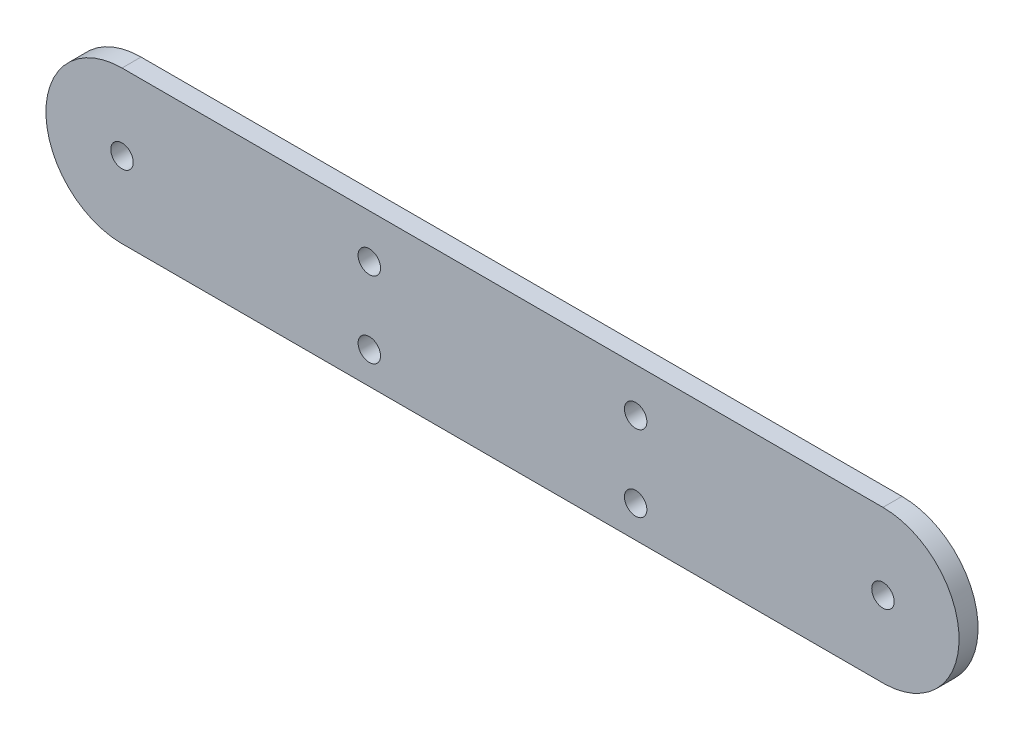
from build123d import *

# Parameters (mm, degrees)
EXTRUIR1_DEPTH        = 2.5
CROQUIS3_R            = 2.95
CORTAR_EXTRUIR1_DEPTH = 10
CROQUIS4_R            = 2.95
CORTAR_EXTRUIR2_DEPTH = 10


with BuildPart() as part:
    # Croquis2 → Extruir1 (new, symmetric)
    with BuildSketch(Plane.XY):
        with BuildLine():
            Line((100.628572724, -18.418297608), (-100.628572724, -18.418297608))
            ThreePointArc((-100.628572724, -18.418297608), (-119.997393731, 1.886143297), (-100, 21.57181808))
            Line((-100, 21.57181808), (100, 21.57181808))
            ThreePointArc((100, 21.57181808), (119.997393731, 1.886143297), (100.628572724, -18.418297608))
        make_face()
    extrude(amount=EXTRUIR1_DEPTH, both=True)

    # Croquis3 → Cortar-Extruir1 (cut)
    with BuildSketch(Plane.XY.offset(2.5)):
        with Locations(Location((99.999863892, 1.57181808, 0), (0, 0, 180))):
            Circle(CROQUIS3_R)
        with Locations((-99.999863892, 1.57181808)):
            Circle(CROQUIS3_R)
    extrude(amount=-CORTAR_EXTRUIR1_DEPTH, mode=Mode.SUBTRACT)

    # Croquis4 → Cortar-Extruir2 (cut)
    with BuildSketch(Plane.XY.offset(2.5)):
        with Locations((-35, 10)):
            Circle(CROQUIS4_R)
        with Locations(Location((-35, -10, 0), (0, 0, 180))):
            Circle(CROQUIS4_R)
        with Locations((35, -10)):
            Circle(CROQUIS4_R)
        with Locations(Location((35, 10, 0), (0, 0, 180))):
            Circle(CROQUIS4_R)
    extrude(amount=-CORTAR_EXTRUIR2_DEPTH, mode=Mode.SUBTRACT)


solid = part.part
